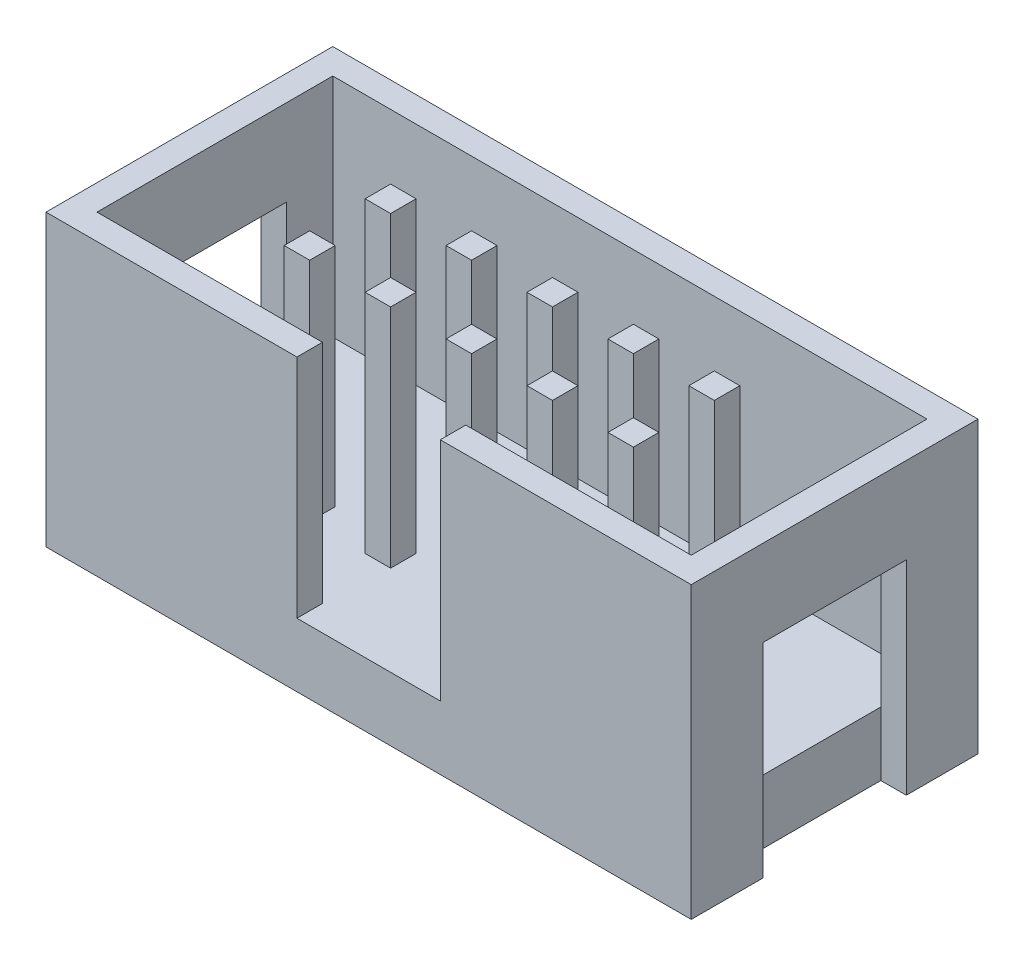
from build123d import *

# Parameters (mm, degrees)
SKETCH1_W           = 20.25
SKETCH1_H           = 9
BOSS_EXTRUDE1_DEPTH = 9.1
SKETCH2_W           = 18.65
SKETCH2_H           = 7.4
CUT_EXTRUDE1_DEPTH  = 7.1
SKETCH2_3_W         = 0.8
SKETCH2_3_H         = 0.8
BOSS_EXTRUDE2_DEPTH = 12.5
SKETCH3_W           = 4.5
SKETCH3_H           = 7.1
CUT_EXTRUDE2_DEPTH  = 2.1
SKETCH5_W           = 4.5
SKETCH5_H           = 6.4
CUT_EXTRUDE3_DEPTH  = 0.8
SKETCH6_W           = 4.5
SKETCH6_H           = 6.4
CUT_EXTRUDE4_DEPTH  = 0.8
SKETCH8_W           = 3.34
SKETCH8_H           = 2
CUT_EXTRUDE5_DEPTH  = 35.242661924


with BuildPart() as part:
    # Sketch1 → Boss-Extrude1 (new body)
    with BuildSketch(Plane(origin=(0, 0, 0), x_dir=(1, 0, 0), z_dir=(0, 1, 0))):
        with Locations((-29.615572658, 24.590099186)):
            Rectangle(SKETCH1_W, SKETCH1_H)
    extrude(amount=BOSS_EXTRUDE1_DEPTH)

    # Sketch2 → Cut-Extrude1 (cut)
    with BuildSketch(Plane(origin=(0, 9.1, 0), x_dir=(1, 0, 0), z_dir=(0, 1, 0))):
        with Locations((-29.615572658, 24.590099186)):
            Rectangle(SKETCH2_W, SKETCH2_H)
    extrude(amount=-CUT_EXTRUDE1_DEPTH, mode=Mode.SUBTRACT)

    # Sketch2<3> → Boss-Extrude2 (add)
    with BuildSketch(Plane(origin=(0, 9.1, 0), x_dir=(1, 0, 0), z_dir=(0, 1, 0))):
        with Locations((-32.155572658, 23.320099186)):
            Rectangle(SKETCH2_3_W, SKETCH2_3_H)
        with Locations((-29.615572658, 23.320099186)):
            Rectangle(SKETCH2_3_W, SKETCH2_3_H)
        with Locations((-27.075572658, 23.320099186)):
            Rectangle(SKETCH2_3_W, SKETCH2_3_H)
        with Locations((-24.535572658, 23.320099186)):
            Rectangle(SKETCH2_3_W, SKETCH2_3_H)
        with Locations((-29.615572658, 25.860099186)):
            Rectangle(SKETCH2_3_W, SKETCH2_3_H)
        with Locations((-27.075572658, 25.860099186)):
            Rectangle(SKETCH2_3_W, SKETCH2_3_H)
        with Locations((-24.535572658, 25.860099186)):
            Rectangle(SKETCH2_3_W, SKETCH2_3_H)
        with Locations((-32.155572658, 25.860099186)):
            Rectangle(SKETCH2_3_W, SKETCH2_3_H)
        with Locations((-34.695572658, 23.320099186)):
            Rectangle(SKETCH2_3_W, SKETCH2_3_H)
        with Locations((-34.695572658, 25.860099186)):
            Rectangle(SKETCH2_3_W, SKETCH2_3_H)
    extrude(amount=-BOSS_EXTRUDE2_DEPTH)

    # Sketch3 → Cut-Extrude2 (cut)
    with BuildSketch(Plane.XY.offset(-20.090099186)):
        with Locations((-29.615572658, 5.55)):
            Rectangle(SKETCH3_W, SKETCH3_H)
    extrude(amount=-CUT_EXTRUDE2_DEPTH, mode=Mode.SUBTRACT)

    # Sketch5 → Cut-Extrude3 (cut)
    with BuildSketch(Plane.ZY.offset(39.740572658)):
        with Locations((-24.590099186, 3.2)):
            Rectangle(SKETCH5_W, SKETCH5_H)
    extrude(amount=-CUT_EXTRUDE3_DEPTH, mode=Mode.SUBTRACT)

    # Sketch6 → Cut-Extrude4 (cut)
    with BuildSketch(Plane(origin=(-19.490572658, 0, 0), x_dir=(0, 0, -1), z_dir=(1, 0, 0))):
        with Locations((24.590099186, 3.2)):
            Rectangle(SKETCH6_W, SKETCH6_H)
    extrude(amount=-CUT_EXTRUDE4_DEPTH, mode=Mode.SUBTRACT)

    # Sketch8 → Cut-Extrude5 (cut, through all)
    with BuildSketch(Plane.ZY.offset(35.095572658)):
        with Locations((-24.590099186, -2.4)):
            Rectangle(SKETCH8_W, SKETCH8_H)
    extrude(amount=-CUT_EXTRUDE5_DEPTH, mode=Mode.SUBTRACT)


solid = part.part
